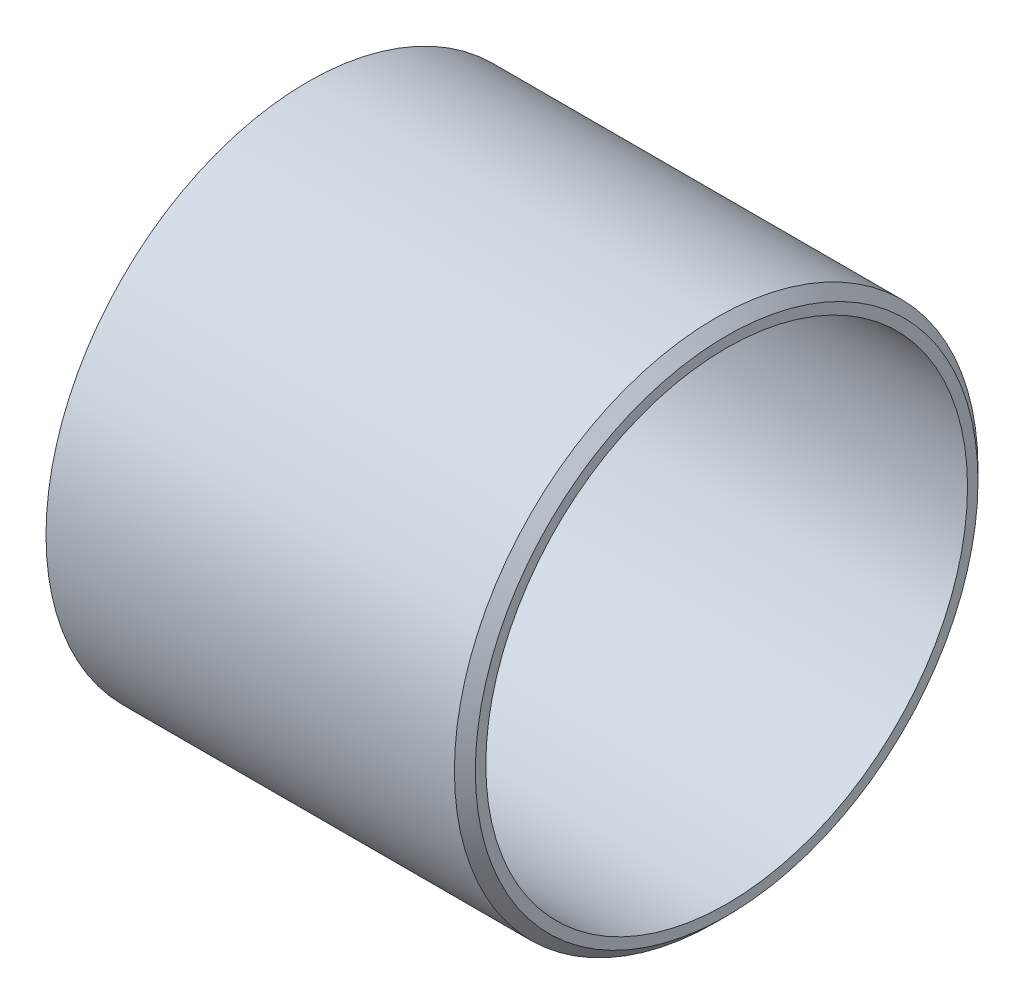
from build123d import *

# Parameters (mm, degrees)
SKETCH1_W     = 40
SKETCH1_H     = 2
CHAMFER1_SIZE = 1


with BuildPart() as part:
    # Sketch1 → Revolve1 (revolve)
    with BuildSketch(Plane.XY, mode=Mode.PRIVATE) as revolve1_sk:
        with Locations((0, 24)):
            Rectangle(SKETCH1_W, SKETCH1_H)
    revolve(revolve1_sk.sketch.rotate(Axis((0, 0, 0), (1, 0, 0)), 90), axis=Axis((0, 0, 0), (1, 0, 0)))

    # Chamfer1
    chamfer1_edges = [part.edges().sort_by_distance(p)[0] for p in [
        (20, 0, -25),
    ]]
    chamfer(chamfer1_edges, length=CHAMFER1_SIZE)


solid = part.part
